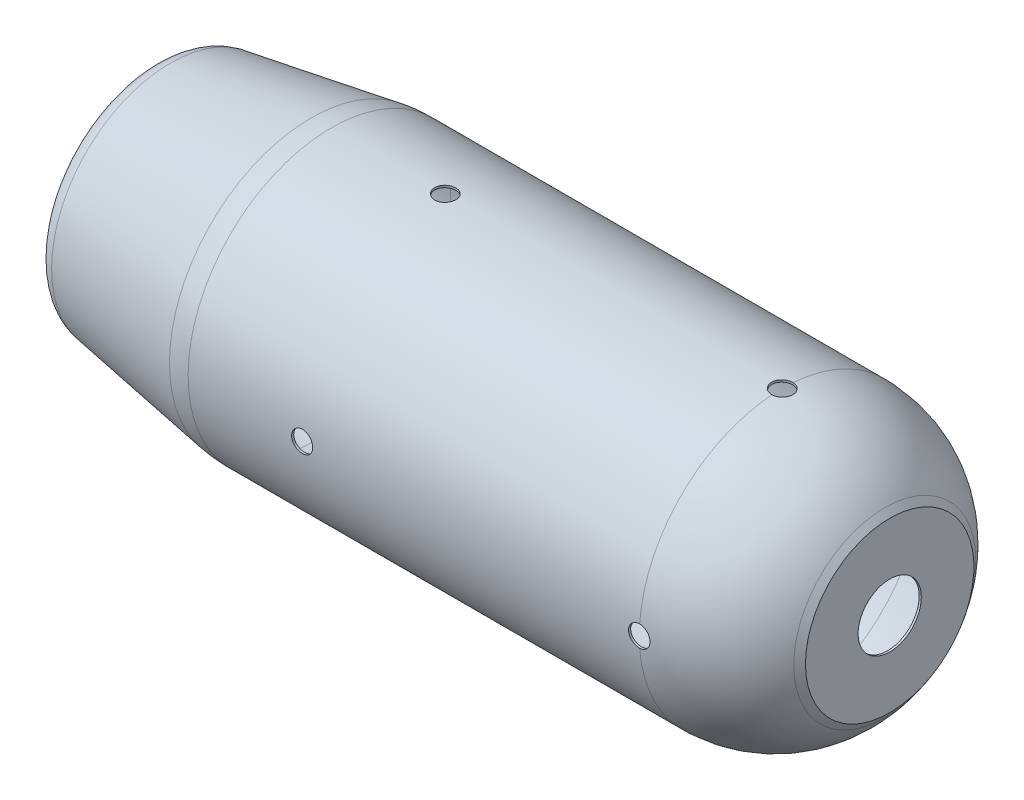
from build123d import *

# Parameters (mm, degrees)
FILLET1_R          = 60
FILLET2_R          = 10
SHELL2_T           = 1
SKETCH3_R          = 1.5
CUT_EXTRUDE1_DEPTH = 10
SKETCH4_R          = 3
CUT_EXTRUDE2_DEPTH = 10
SKETCH5_R          = 5
CUT_EXTRUDE3_DEPTH = 90
CIRPATTERN1_COUNT  = 4
SKETCH6_R          = 15
CUT_EXTRUDE4_DEPTH = 10


with BuildPart() as part:
    # Sketch1 → Revolve1 (revolve)
    with BuildSketch(Plane.XY, mode=Mode.PRIVATE) as revolve1_sk:
        Polygon((0, 0), (0, 55), (80, 68), (329.7024, 68), (350, 40), (350, 0), align=None)
    revolve(revolve1_sk.sketch.rotate(Axis((0, 0, 0), (1, 0, 0)), 90), axis=Axis((0, 0, 0), (1, 0, 0)))

    # Fillet1
    fillet1_edges = [part.edges().sort_by_distance(p)[0] for p in [
        (329.7024, 0, -68),
        (80, 0, -68),
    ]]
    fillet(fillet1_edges, radius=FILLET1_R)

    # Fillet2
    fillet2_edges = [part.edges().sort_by_distance(p)[0] for p in [
        (0, 0, -55),
    ]]
    fillet(fillet2_edges, radius=FILLET2_R)

    # Shell2 (no face opened: a closed hollow body)
    add(offset(amount=-SHELL2_T, mode=Mode.PRIVATE), mode=Mode.SUBTRACT)

    # Sketch3 → Cut-Extrude1 (cut)
    with BuildSketch(Plane.ZY):
        Circle(SKETCH3_R)
    extrude(amount=-CUT_EXTRUDE1_DEPTH, mode=Mode.SUBTRACT)

    # Sketch4 → Cut-Extrude2 (cut)
    with BuildSketch(Plane.ZY):
        with Locations((28.284271247, 28.284271247)):
            Circle(SKETCH4_R)
        with Locations((28.284271247, -28.284271247)):
            Circle(SKETCH4_R)
        with Locations((-28.284271247, -28.284271247)):
            Circle(SKETCH4_R)
        with Locations((-28.284271247, 28.284271247)):
            Circle(SKETCH4_R)
    extrude(amount=-CUT_EXTRUDE2_DEPTH, mode=Mode.SUBTRACT)

    # Sketch5 → Cut-Extrude3 (cut)
    with BuildSketch(Plane.XY):
        with Locations((139, 0)):
            Circle(SKETCH5_R)
        with Locations(Location((299, 0, 0), (0, 0, 271.037795086))):
            Circle(SKETCH5_R)
    cut_extrude3 = extrude(amount=-CUT_EXTRUDE3_DEPTH, mode=Mode.SUBTRACT)

    # CirPattern1: Cut-Extrude3 ×4 about axis
    cirpattern1_axis = Axis((80, 0, 0), (1, 0, 0))
    for i in range(1, CIRPATTERN1_COUNT):
        add(cut_extrude3.rotate(cirpattern1_axis, i * 360 / CIRPATTERN1_COUNT), mode=Mode.SUBTRACT)

    # Sketch6 → Cut-Extrude4 (cut)
    with BuildSketch(Plane(origin=(350, 0, 0), x_dir=(0, 0, -1), z_dir=(1, 0, 0))):
        Circle(SKETCH6_R)
    extrude(amount=-CUT_EXTRUDE4_DEPTH, mode=Mode.SUBTRACT)


solid = part.part
